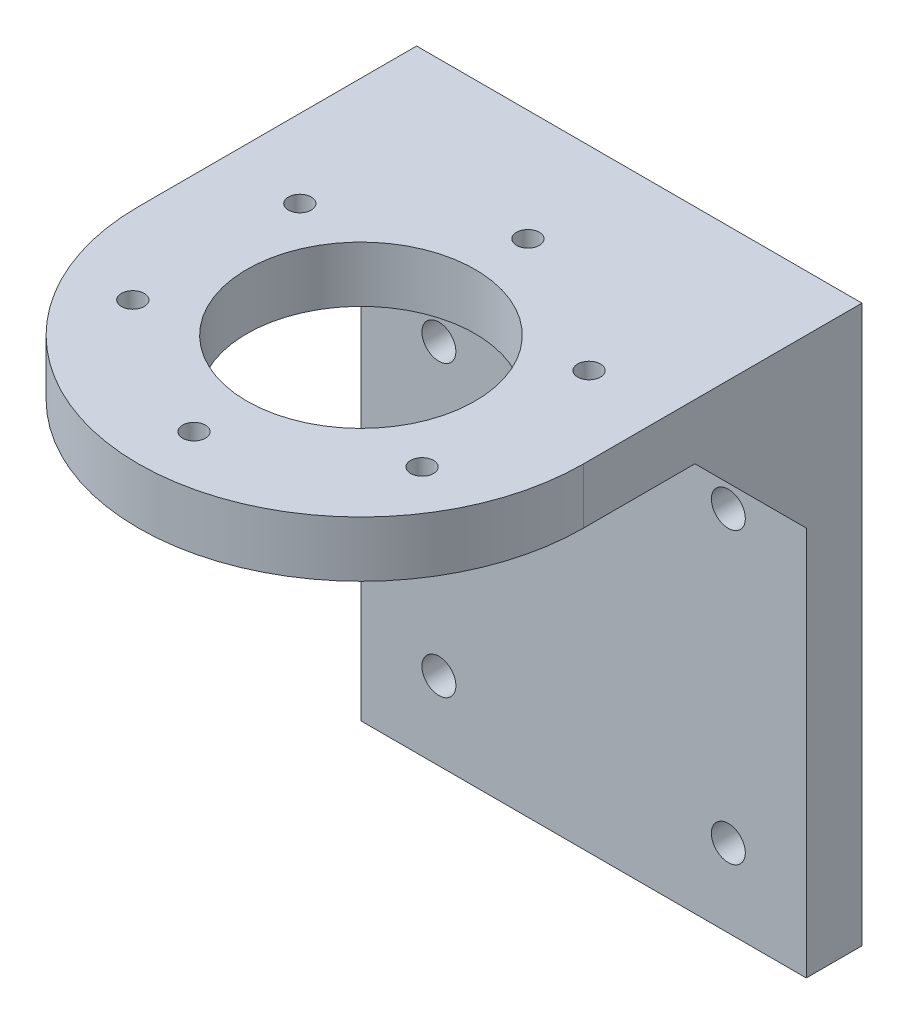
from build123d import *

# Parameters (mm, degrees)
SKETCH_1_R          = 1.025
SKETCH_1_R_2        = 10.25
EXTRUDE_2_DEPTH     = 5
SKETCH_2_W          = 40
SKETCH_2_H          = 5
EXTRUDE_3_DEPTH     = 50
CUT_EXTRUDE_1_REACH = 77.166
SKETCH_3_R          = 1.525
EXTRUDE_4_DEPTH     = 3
EXTRUDE_5_DEPTH     = 3


with BuildPart() as part:
    # 草图1 → 凸台-拉伸2 (new body)
    with BuildSketch(Plane(origin=(0, 0, 0), x_dir=(1, 0, 0), z_dir=(0, 1, 0))):
        with BuildLine():
            ThreePointArc((0, 20), (5.857864376, 5.857864376), (20, 0))
            ThreePointArc((20, 0), (34.142135624, 5.857864376), (40, 20))
            Line((40, 20), (40, 40))
            Line((40, 40), (0, 40))
            Line((0, 40), (0, 20))
        make_face()
        with Locations(Location((7.009618943, 12.5, 0), (0, 0, 270))):
            Circle(SKETCH_1_R, mode=Mode.SUBTRACT)
        with Locations(Location((20, 5, 0), (0, 0, 270))):
            Circle(SKETCH_1_R, mode=Mode.SUBTRACT)
        with Locations(Location((32.990381057, 12.5, 0), (0, 0, 270))):
            Circle(SKETCH_1_R, mode=Mode.SUBTRACT)
        with Locations(Location((7.009618943, 27.5, 0), (0, 0, 270))):
            Circle(SKETCH_1_R, mode=Mode.SUBTRACT)
        with Locations(Location((20, 20, 0), (0, 0, 270))):
            Circle(SKETCH_1_R_2, mode=Mode.SUBTRACT)
        with Locations(Location((32.990381057, 27.5, 0), (0, 0, 270))):
            Circle(SKETCH_1_R, mode=Mode.SUBTRACT)
        with Locations(Location((20, 35, 0), (0, 0, 270))):
            Circle(SKETCH_1_R, mode=Mode.SUBTRACT)
    extrude(amount=EXTRUDE_2_DEPTH)

    # 草图2 → 凸台-拉伸3 (add)
    with BuildSketch(Plane(origin=(0, 5, 0), x_dir=(1, 0, 0), z_dir=(0, 1, 0))):
        with Locations((20, 42.5)):
            Rectangle(SKETCH_2_W, SKETCH_2_H)
    extrude(amount=-EXTRUDE_3_DEPTH)

    # 草图3 → 切除-拉伸1 (cut, up to next)
    with BuildSketch(Plane(origin=(0, 0, -45), x_dir=(-1, 0, 0), z_dir=(0, 0, -1)), mode=Mode.PRIVATE) as cut_extrude_1_sk1:
        with Locations((-7, -12)):
            Circle(SKETCH_3_R)
    cut_extrude_1_tool1 = extrude(cut_extrude_1_sk1.sketch, amount=-CUT_EXTRUDE_1_REACH, mode=Mode.PRIVATE) & part.part
    # 草图3 → 切除-拉伸1 (cut, up to next)
    with BuildSketch(Plane(origin=(0, 0, -45), x_dir=(-1, 0, 0), z_dir=(0, 0, -1)), mode=Mode.PRIVATE) as cut_extrude_1_sk2:
        with Locations((-7, -38)):
            Circle(SKETCH_3_R)
    cut_extrude_1_tool2 = extrude(cut_extrude_1_sk2.sketch, amount=-CUT_EXTRUDE_1_REACH, mode=Mode.PRIVATE) & part.part
    # 草图3 → 切除-拉伸1 (cut, up to next)
    with BuildSketch(Plane(origin=(0, 0, -45), x_dir=(-1, 0, 0), z_dir=(0, 0, -1)), mode=Mode.PRIVATE) as cut_extrude_1_sk3:
        with Locations((-33, -38)):
            Circle(SKETCH_3_R)
    cut_extrude_1_tool3 = extrude(cut_extrude_1_sk3.sketch, amount=-CUT_EXTRUDE_1_REACH, mode=Mode.PRIVATE) & part.part
    # 草图3 → 切除-拉伸1 (cut, up to next)
    with BuildSketch(Plane(origin=(0, 0, -45), x_dir=(-1, 0, 0), z_dir=(0, 0, -1)), mode=Mode.PRIVATE) as cut_extrude_1_sk4:
        with Locations((-33, -12)):
            Circle(SKETCH_3_R)
    cut_extrude_1_tool4 = extrude(cut_extrude_1_sk4.sketch, amount=-CUT_EXTRUDE_1_REACH, mode=Mode.PRIVATE) & part.part
    add(cut_extrude_1_tool1.solids().sort_by_distance((7, -12, -45))[0], mode=Mode.SUBTRACT)
    add(cut_extrude_1_tool2.solids().sort_by_distance((7, -38, -45))[0], mode=Mode.SUBTRACT)
    add(cut_extrude_1_tool3.solids().sort_by_distance((33, -38, -45))[0], mode=Mode.SUBTRACT)
    add(cut_extrude_1_tool4.solids().sort_by_distance((33, -12, -45))[0], mode=Mode.SUBTRACT)

    # 草图4 → 凸台-拉伸4 (add)
    with BuildSketch(Plane.ZY):
        Polygon((-30, 0), (-40, 0), (-40, -10), align=None)
    extrude(amount=-EXTRUDE_4_DEPTH)

    # 草图5 → 凸台-拉伸5 (add)
    with BuildSketch(Plane(origin=(40, 0, 0), x_dir=(0, 0, -1), z_dir=(1, 0, 0))):
        Polygon((40, -10), (40, 0), (30, 0), align=None)
    extrude(amount=-EXTRUDE_5_DEPTH)


solid = part.part
